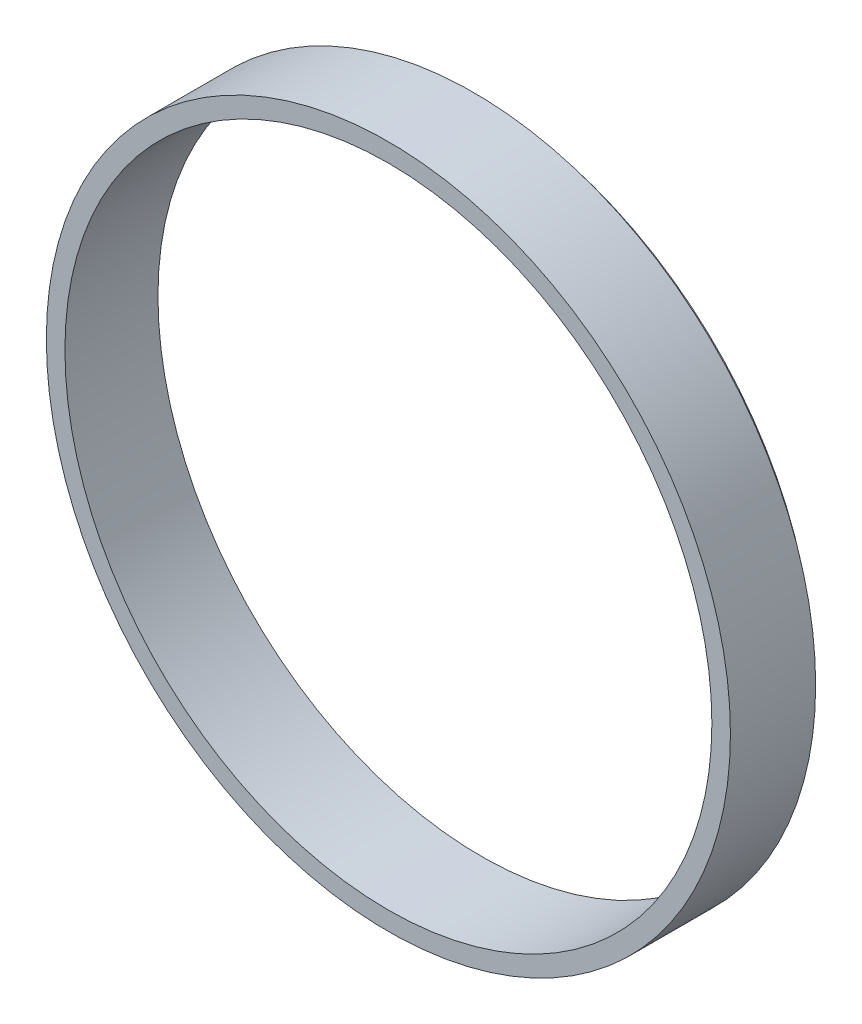
from build123d import *

# Parameters (mm, degrees)
SKETCH1_R                       = 87.5
SKETCH1_R_2                     = 83.75
BOSS_EXTRUDE1_DEPTH             = 21.8
SKETCH2_R                       = 85
SKETCH2_R_2                     = 82.75
BOSS_EXTRUDE2_DEPTH             = 2
BOSS_EXTRUDE2_DIRECTION_2_REACH = 127.649


with BuildPart() as part:
    # Sketch1 → Boss-Extrude1 (new body)
    with BuildSketch(Plane.XY):
        Circle(SKETCH1_R)
        Circle(SKETCH1_R_2, mode=Mode.SUBTRACT)
    extrude(amount=BOSS_EXTRUDE1_DEPTH)

    # Sketch2 → Boss-Extrude2 (add)
    with BuildSketch(Plane(origin=(0, 0, 0), x_dir=(-1, 0, 0), z_dir=(0, 0, -1))):
        Circle(SKETCH2_R)
        Circle(SKETCH2_R_2, mode=Mode.SUBTRACT)
    extrude(amount=BOSS_EXTRUDE2_DEPTH)

    # Boss-Extrude2 direction 2: up to this face of the body (flat: up to its plane)
    boss_extrude2_direction_2_end = Plane(part.part.faces().sort_by_distance((-85.025126266, 0, 21.8))[0])
    # Sketch2 → Boss-Extrude2 direction 2 (add, up to the picked face)
    with BuildSketch(Plane(origin=(0, 0, 0), x_dir=(-1, 0, 0), z_dir=(0, 0, -1)), mode=Mode.PRIVATE) as boss_extrude2_direction_2_sk1:
        Circle(SKETCH2_R)
        Circle(SKETCH2_R_2, mode=Mode.SUBTRACT)
    boss_extrude2_direction_2_tool1 = split(extrude(boss_extrude2_direction_2_sk1.sketch, amount=-BOSS_EXTRUDE2_DIRECTION_2_REACH, mode=Mode.PRIVATE), bisect_by=boss_extrude2_direction_2_end, keep=Keep.BOTH, mode=Mode.PRIVATE)
    add(boss_extrude2_direction_2_tool1.solids().sort_by(Axis((84.759584, 0, 0), (0, 0, 1)))[0])


solid = part.part
